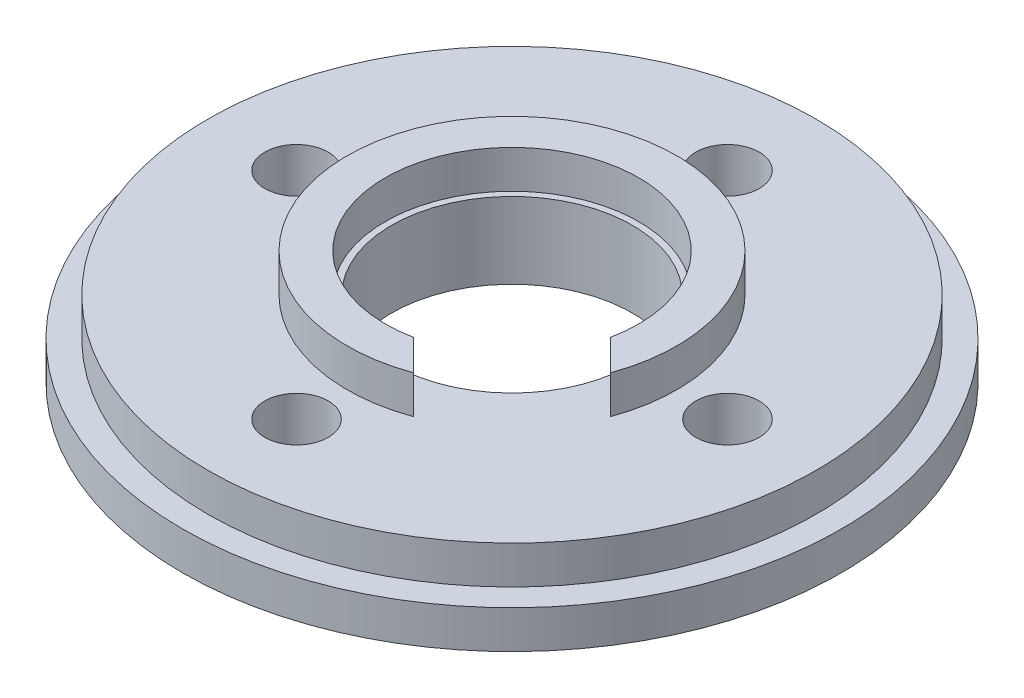
from build123d import *

# Parameters (mm, degrees)
SKETCH1_R           = 13
BOSS_EXTRUDE1_DEPTH = 1.5
SKETCH2_R           = 12
BOSS_EXTRUDE2_DEPTH = 1.5
SKETCH3_R           = 6.5
BOSS_EXTRUDE3_DEPTH = 1.5
SKETCH4_R           = 1.25
CUT_EXTRUDE1_DEPTH  = 11.5
SKETCH5_R           = 4.75
CUT_EXTRUDE2_DEPTH  = 11.5
SKETCH6_R           = 5
CUT_EXTRUDE3_DEPTH  = 1.5
CUT_EXTRUDE4_DEPTH  = 1.5


with BuildPart() as part:
    # Sketch1 → Boss-Extrude1 (new body)
    with BuildSketch(Plane(origin=(0, 0, 0), x_dir=(1, 0, 0), z_dir=(0, 1, 0))):
        with Locations(Location((0, 0, 0), (0, 0, 270))):
            Circle(SKETCH1_R)
    extrude(amount=BOSS_EXTRUDE1_DEPTH)

    # Sketch2 → Boss-Extrude2 (add)
    with BuildSketch(Plane(origin=(0, 1.5, 0), x_dir=(1, 0, 0), z_dir=(0, 1, 0))):
        with Locations(Location((0, 0, 0), (0, 0, 270))):
            Circle(SKETCH2_R)
    extrude(amount=BOSS_EXTRUDE2_DEPTH)

    # Sketch3 → Boss-Extrude3 (add)
    with BuildSketch(Plane(origin=(0, 3, 0), x_dir=(1, 0, 0), z_dir=(0, 1, 0))):
        with Locations(Location((0, 0, 0), (0, 0, 270))):
            Circle(SKETCH3_R)
    extrude(amount=BOSS_EXTRUDE3_DEPTH)

    # Sketch4 → Cut-Extrude1 (cut)
    with BuildSketch(Plane(origin=(0, 3, 0), x_dir=(1, 0, 0), z_dir=(0, 1, 0))):
        with Locations(Location((-8.5, 0, 0), (0, 0, 270))):
            Circle(SKETCH4_R)
        with Locations(Location((0, 8.5, 0), (0, 0, 270))):
            Circle(SKETCH4_R)
        with Locations(Location((8.5, 0, 0), (0, 0, 270))):
            Circle(SKETCH4_R)
        with Locations(Location((0, -8.5, 0), (0, 0, 270))):
            Circle(SKETCH4_R)
    extrude(amount=-CUT_EXTRUDE1_DEPTH, mode=Mode.SUBTRACT)

    # Sketch5 → Cut-Extrude2 (cut)
    with BuildSketch(Plane(origin=(0, 4.5, 0), x_dir=(1, 0, 0), z_dir=(0, 1, 0))):
        with Locations(Location((0, 0, 0), (0, 0, 270))):
            Circle(SKETCH5_R)
    extrude(amount=-CUT_EXTRUDE2_DEPTH, mode=Mode.SUBTRACT)

    # Sketch6 → Cut-Extrude3 (cut)
    with BuildSketch(Plane(origin=(0, 4.5, 0), x_dir=(1, 0, 0), z_dir=(0, 1, 0))):
        with Locations(Location((0, 0, 0), (0, 0, 270))):
            Circle(SKETCH6_R)
    extrude(amount=-CUT_EXTRUDE3_DEPTH, mode=Mode.SUBTRACT)

    # Sketch7 → Cut-Extrude4 (cut)
    with BuildSketch(Plane(origin=(0, 4.5, 0), x_dir=(1, 0, 0), z_dir=(0, 1, 0))):
        Polygon((0.767606776, -4.656694072), (4.656694072, -0.767606776), (9.347013617, -5.457926321), (5.457926321, -9.347013617), align=None)
    extrude(amount=-CUT_EXTRUDE4_DEPTH, mode=Mode.SUBTRACT)


solid = part.part
